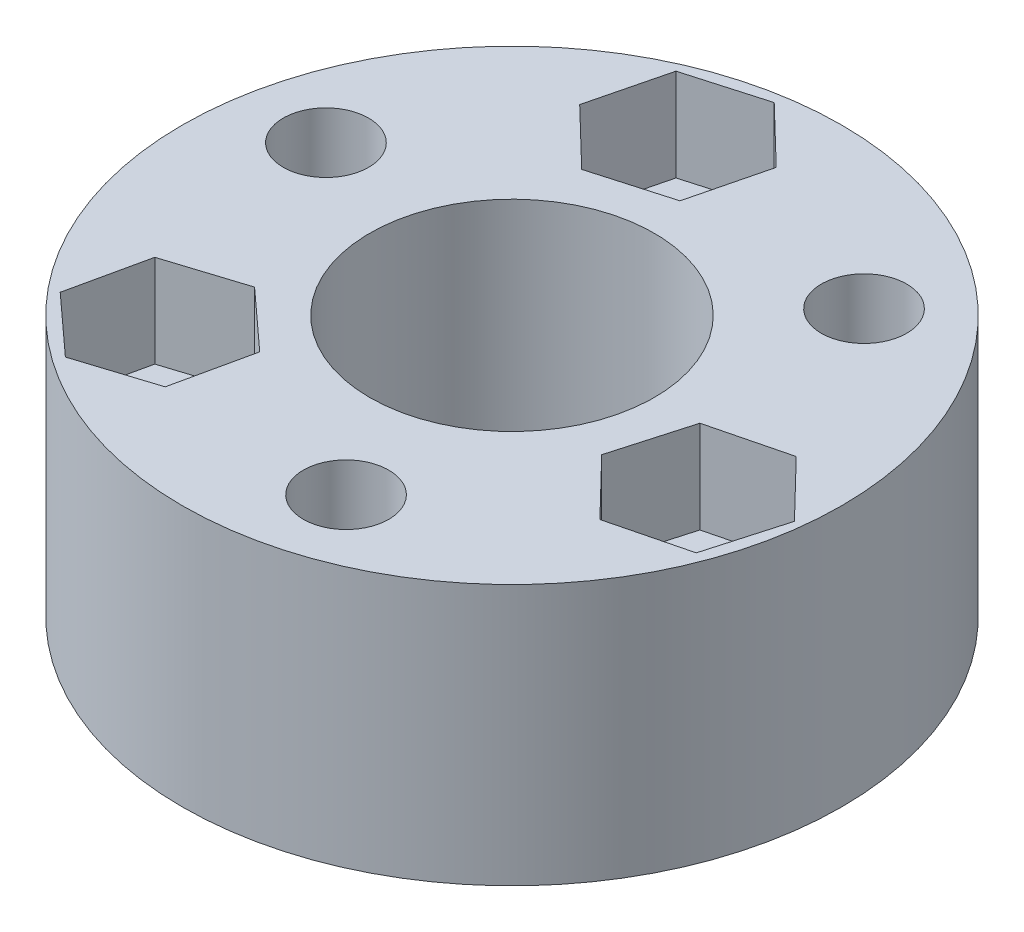
from build123d import *

# Parameters (mm, degrees)
ESQUISSE3_R             = 13.9
ESQUISSE3_R_2           = 6
ESQUISSE3_R_3           = 1.8
BOSS_EXTRU_1_DEPTH      = 11
ENL_V_MAT_EXTRU_1_DEPTH = 3.9


with BuildPart() as part:
    # Esquisse3 → Boss.-Extru.1 (new body)
    with BuildSketch(Plane(origin=(0, 0, 0), x_dir=(1, 0, 0), z_dir=(0, 1, 0))):
        with Locations(Location((0, 0, 0), (0, 0, 270))):
            Circle(ESQUISSE3_R)
        with Locations(Location((0, 0, 0), (0, 0, 270))):
            Circle(ESQUISSE3_R_2, mode=Mode.SUBTRACT)
        with Locations(Location((-3.050511372, 10.04710806, 0), (0, 0, 270))):
            Circle(ESQUISSE3_R_3, mode=Mode.SUBTRACT)
        with Locations(Location((7.175795129, 7.665374373, 0), (0, 0, 270))):
            Circle(ESQUISSE3_R_3, mode=Mode.SUBTRACT)
        with Locations(Location((10.2263065, -2.381733688, 0), (0, 0, 270))):
            Circle(ESQUISSE3_R_3, mode=Mode.SUBTRACT)
        with Locations(Location((3.050511372, -10.04710806, 0), (0, 0, 270))):
            Circle(ESQUISSE3_R_3, mode=Mode.SUBTRACT)
        with Locations(Location((-7.175795129, -7.665374373, 0), (0, 0, 270))):
            Circle(ESQUISSE3_R_3, mode=Mode.SUBTRACT)
        with Locations(Location((-10.2263065, 2.381733688, 0), (0, 0, 270))):
            Circle(ESQUISSE3_R_3, mode=Mode.SUBTRACT)
    extrude(amount=BOSS_EXTRU_1_DEPTH)

    # Esquisse4 → Enlèv. mat.-Extru.1 (cut)
    with BuildSketch(Plane(origin=(0, 11, 0), x_dir=(1, 0, 0), z_dir=(0, 1, 0))):
        Polygon((-3.859043077, 6.797552734), (-0.640579761, 7.722121401), (0.167951944, 10.971676727), (-2.241979667, 13.296663386), (-5.460442982, 12.372094719), (-6.268974687, 9.122539393), align=None)
        Polygon((12.555495262, -4.787604225), (13.474445885, -1.567532319), (11.145257124, 0.838338219), (7.897117739, 0.02413685), (6.978167116, -3.195935057), (9.307355877, -5.601805594), align=None)
        Polygon((-4.701263167, -9.921482726), (-3.984682, -6.650421008), (-6.459213962, -4.394312654), (-9.650327091, -5.409266019), (-10.366908258, -8.680327737), (-7.892376296, -10.936436091), align=None)
    extrude(amount=-ENL_V_MAT_EXTRU_1_DEPTH, mode=Mode.SUBTRACT)


solid = part.part
